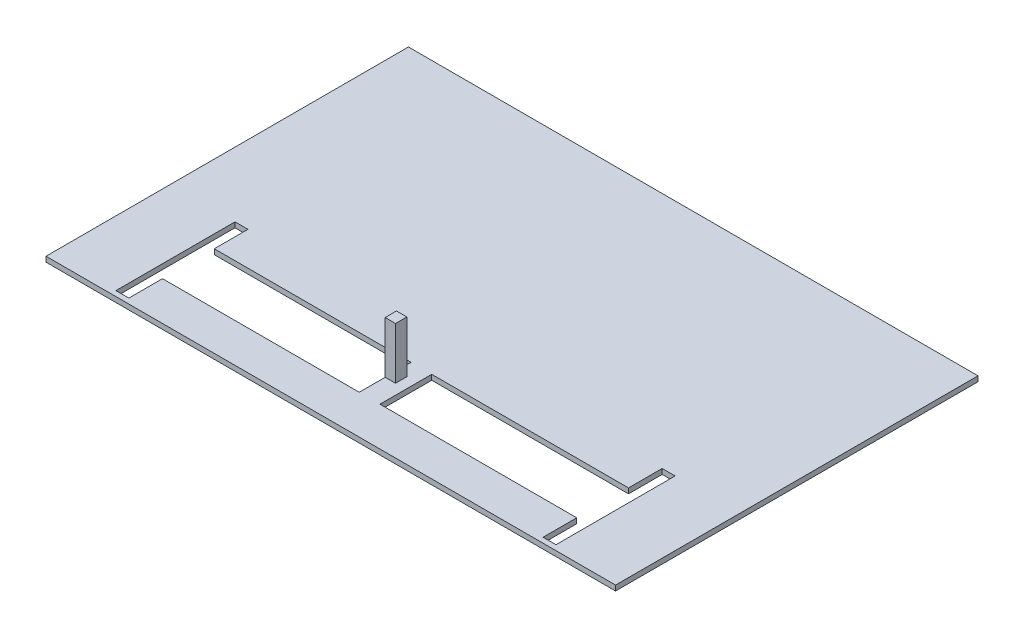
from build123d import *

# Parameters (mm, degrees)
SKETCH2_W           = 220
SKETCH2_H           = 140
BOSS_EXTRUDE1_DEPTH = 2
CUT_EXTRUDE1_DEPTH  = 2
SKETCH4_W           = 8
SKETCH4_H           = 20
BOSS_EXTRUDE2_DEPTH = 2
SKETCH5_W           = 4
SKETCH5_H           = 4.381248614
BOSS_EXTRUDE3_DEPTH = 20


with BuildPart() as part:
    # Sketch2 → Boss-Extrude1 (new body)
    with BuildSketch(Plane(origin=(0, 0, 0), x_dir=(1, 0, 0), z_dir=(0, 1, 0))):
        Rectangle(SKETCH2_W, SKETCH2_H)
    extrude(amount=BOSS_EXTRUDE1_DEPTH)

    # Sketch3 → Cut-Extrude1 (cut)
    with BuildSketch(Plane(origin=(0, 0, 0), x_dir=(1, 0, 0), z_dir=(0, 1, 0))):
        Polygon((-80, -35), (-80, -22), (-85, -22), (-85, -68), (-80, -68), (-80, -55), (80, -55), (80, -68), (85, -68), (85, -22), (80, -22), (80, -35), align=None)
    extrude(amount=CUT_EXTRUDE1_DEPTH, mode=Mode.SUBTRACT)

    # Sketch4 → Boss-Extrude2 (add)
    with BuildSketch(Plane(origin=(0, 0, 0), x_dir=(1, 0, 0), z_dir=(0, 1, 0))):
        with Locations((0, -45)):
            Rectangle(SKETCH4_W, SKETCH4_H)
    extrude(amount=BOSS_EXTRUDE2_DEPTH)

    # Sketch5 → Boss-Extrude3 (add)
    with BuildSketch(Plane(origin=(0, 2, 0), x_dir=(1, 0, 0), z_dir=(0, 1, 0))):
        with Locations((-2, -42.809375693)):
            Rectangle(SKETCH5_W, SKETCH5_H)
    extrude(amount=BOSS_EXTRUDE3_DEPTH)


solid = part.part
